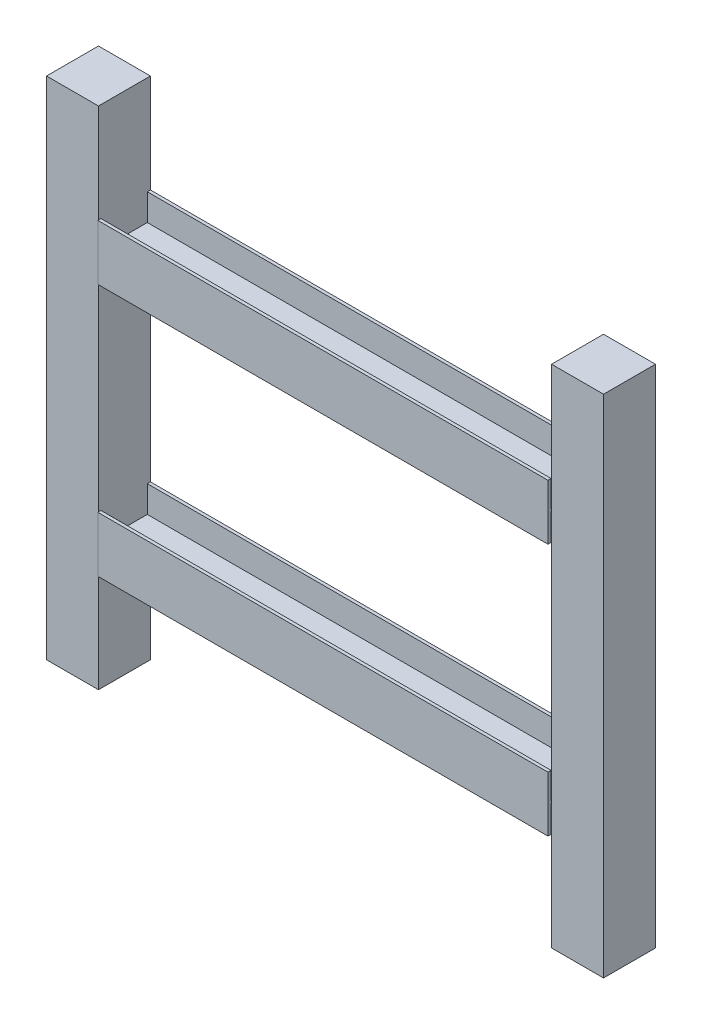
from build123d import *

# Parameters (mm, degrees)
SKETCH1_W             = 150
SKETCH1_H             = 150
BOSS_EXTRUDE1_DEPTH   = 1460
BOSS_EXTRUDE1_2_DEPTH = 1460
BOSS_EXTRUDE2_DEPTH   = 1300
BOSS_EXTRUDE2_2_DEPTH = 1300


with BuildPart() as part:
    # Sketch1 → Boss-Extrude1 (new body)
    with BuildSketch(Plane(origin=(0, 0, 0), x_dir=(1, 0, 0), z_dir=(0, 1, 0))):
        with Locations((1484.462268864, 47.010460547)):
            Rectangle(SKETCH1_W, SKETCH1_H)
    extrude(amount=BOSS_EXTRUDE1_DEPTH)


with BuildPart() as body_2:
    # Sketch1 → Boss-Extrude1 2 (new body)
    with BuildSketch(Plane(origin=(0, 0, 0), x_dir=(1, 0, 0), z_dir=(0, 1, 0))):
        with Locations((34.462268864, 38.565781525)):
            Rectangle(SKETCH1_W, SKETCH1_H)
    extrude(amount=BOSS_EXTRUDE1_2_DEPTH)


with BuildPart() as body_3:
    # Sketch3 → Boss-Extrude2 (new body)
    with BuildSketch(Plane(origin=(109.462268864, 0, 0), x_dir=(0, 0, -1), z_dir=(1, 0, 0))):
        Polygon((-38.43421847, 284.99999996), (-38.43421847, 444.99999993), (-29.43421847, 444.99999993), (-29.43421847, 367.99999993), (104.565781535, 367.99999993), (104.565781535, 445.000000025), (113.565781515, 445.000000025), (113.565781515, 284.999999975), (104.565781535, 284.999999975), (104.565781535, 361.99999996), (-29.43421847, 361.99999996), (-29.43421847, 284.99999996), align=None)
    extrude(amount=BOSS_EXTRUDE2_DEPTH)


with BuildPart() as body_4:
    # Sketch3 → Boss-Extrude2 2 (new body)
    with BuildSketch(Plane(origin=(109.462268864, 0, 0), x_dir=(0, 0, -1), z_dir=(1, 0, 0))):
        Polygon((-29.43421847, 1097.99999993), (-29.43421847, 1174.99999993), (-38.43421847, 1174.99999993), (-38.43421847, 1014.99999996), (-29.43421847, 1014.99999996), (-29.43421847, 1091.99999996), (104.565781535, 1091.99999996), (104.565781535, 1014.999999975), (113.565781515, 1014.999999975), (113.565781515, 1175.000000025), (104.565781535, 1175.000000025), (104.565781535, 1097.99999993), align=None)
    extrude(amount=BOSS_EXTRUDE2_2_DEPTH)


solid = Compound([part.part, body_2.part, body_3.part, body_4.part])
